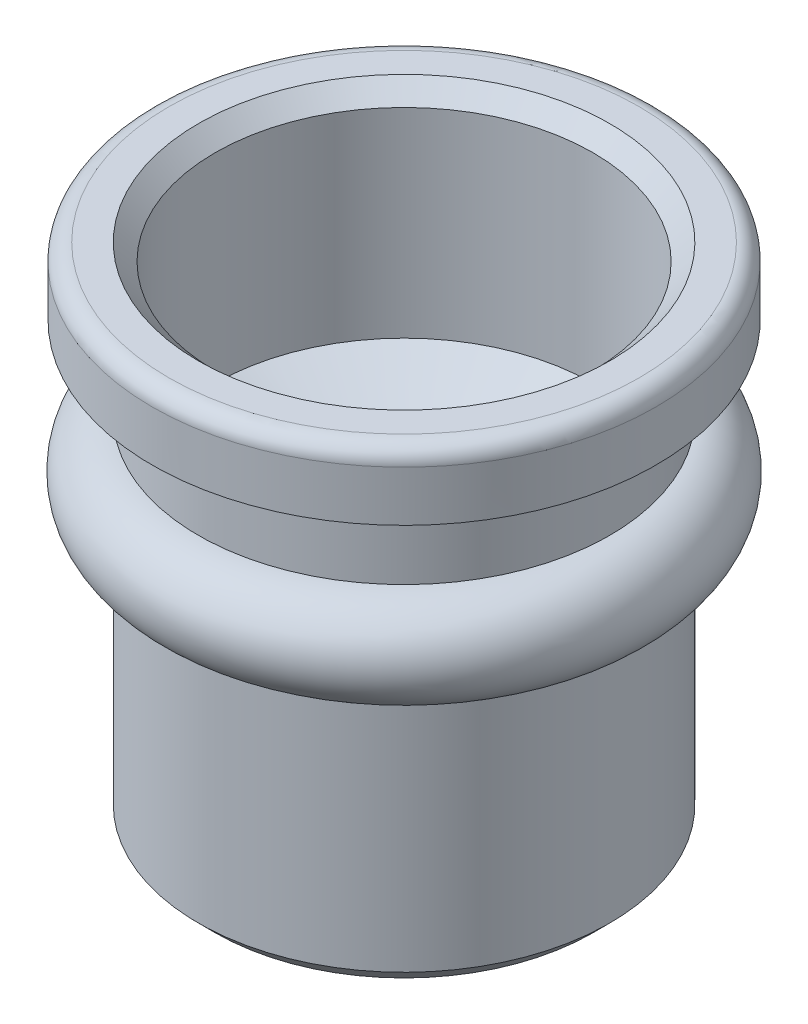
from build123d import *

# Parameters (mm, degrees)
FILLET_2_R            = 0.2
HOLE_WIZARD_M31_D     = 2.5
HOLE_WIZARD_M31_DEPTH = 4
HOLE_WIZARD_M31_TIP   = 0.751075774
CHAMFER_2_SIZE        = 0.15
CHAMFER_3_SIZE        = 0.2
CHAMFER_6_SIZE        = 0.2


with BuildPart() as part:
    # Эскиз1 → Повернуть1 (revolve)
    with BuildSketch(Plane.XY, mode=Mode.PRIVATE) as revolve_1_sk:
        Polygon((0, 0), (2.45, 0), (2.45, 5.2), (3, 5.2), (3, 6), (0, 6), align=None)
    revolve(revolve_1_sk.sketch.rotate(Axis((0, 0, 0), (0, 1, 0)), 90), axis=Axis((0, 0, 0), (0, 1, 0)))

    # Скругление2
    fillet_2_edges = [part.edges().sort_by_distance(p)[0] for p in [
        (0, 6, 3),
    ]]
    fillet(fillet_2_edges, radius=FILLET_2_R)

    # Отверстие обработанное метчиком M31
    with Locations(Plane(origin=(0, 0, 0), x_dir=(-1, 0, 0), z_dir=(0, -1, 0))):
        with Locations((0, 0)):
            Hole(HOLE_WIZARD_M31_D / 2, depth=HOLE_WIZARD_M31_DEPTH)
            with Locations((0, 0, -(HOLE_WIZARD_M31_DEPTH + HOLE_WIZARD_M31_TIP / 2))):  # 118° drill point
                Cone(0, HOLE_WIZARD_M31_D / 2, HOLE_WIZARD_M31_TIP, mode=Mode.SUBTRACT)

    # Фаска2
    chamfer_2_edges = [part.edges().sort_by_distance(p)[0] for p in [
        (-1.25, 0, 0),
    ]]
    chamfer(chamfer_2_edges, length=CHAMFER_2_SIZE)

    # Эскиз8 → Вырез-Повернуть1 (revolve, cut)
    with BuildSketch(Plane.XY, mode=Mode.PRIVATE) as cut_revolve_1_sk:
        Polygon((2.25, 6), (2.25, 3.419676892), (1.35, 3), (0, 3), (0, 6), align=None)
    revolve(cut_revolve_1_sk.sketch.rotate(Axis((0, 6, 0), (0, -1, 0)), 90), axis=Axis((0, 6, 0), (0, -1, 0)), mode=Mode.SUBTRACT)

    # Эскиз9 → Повернуть3 (revolve)
    with BuildSketch(Plane.XY, mode=Mode.PRIVATE) as revolve_3_sk:
        with BuildLine():
            Line((-2.45, 4.2), (-2.45, 3.08))
            ThreePointArc((-2.45, 3.08), (-3.01, 3.64), (-2.45, 4.2))
        make_face()
    revolve(revolve_3_sk.sketch.rotate(Axis((0, 0, 0), (0, 1, 0)), 270), axis=Axis((0, 0, 0), (0, 1, 0)))

    # Фаска3
    chamfer_3_edges = [part.edges().sort_by_distance(p)[0] for p in [
        (0, 0, 2.45),
    ]]
    chamfer(chamfer_3_edges, length=CHAMFER_3_SIZE)

    # Фаска6
    chamfer_6_edges = [part.edges().sort_by_distance(p)[0] for p in [
        (0, 6, -2.25),
    ]]
    chamfer(chamfer_6_edges, length=CHAMFER_6_SIZE)


solid = part.part
